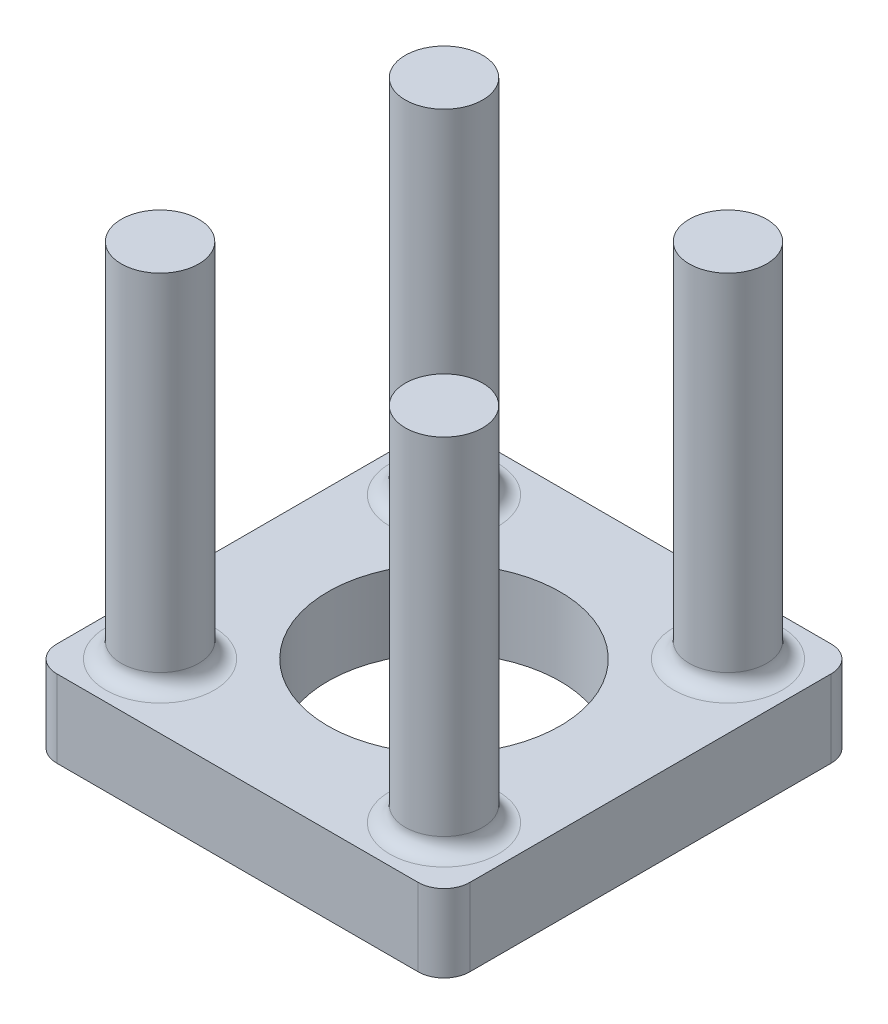
from build123d import *

# Parameters (mm, degrees)
SKETCH_1_W      = 80
SKETCH_1_H      = 80
SKETCH_1_R      = 22.5
EXTRUDE_1_DEPTH = 15
FILLET_1_R      = 5
SKETCH_2_R      = 7.5
EXTRUDE_2_DEPTH = 70
FILLET_2_R      = 3


with BuildPart() as part:
    # 草圖1 → 填料-伸長1 (new body)
    with BuildSketch(Plane(origin=(0, 0, 0), x_dir=(1, 0, 0), z_dir=(0, 1, 0))):
        with Locations((11.024390244, -21.451219512)):
            Rectangle(SKETCH_1_W, SKETCH_1_H)
        with Locations(Location((11.024390244, -21.451219512, 0), (0, 0, 270))):
            Circle(SKETCH_1_R, mode=Mode.SUBTRACT)
    extrude(amount=EXTRUDE_1_DEPTH)

    # 圓角1
    fillet_1_edges = [part.edges().sort_by_distance(p)[0] for p in [
        (-28.975609756, 7.5, -18.548780488),
        (51.024390244, 7.5, -18.548780488),
        (51.024390244, 7.5, 61.451219512),
        (-28.975609756, 7.5, 61.451219512),
    ]]
    fillet(fillet_1_edges, radius=FILLET_1_R)

    # 草圖2 → 填料-伸長2 (add)
    with BuildSketch(Plane(origin=(0, 15, 0), x_dir=(1, 0, 0), z_dir=(0, 1, 0))):
        with Locations(Location((-16.475609756, 6.048780488, 0), (0, 0, 270))):
            Circle(SKETCH_2_R)
        with Locations(Location((38.524390244, 6.048780488, 0), (0, 0, 270))):
            Circle(SKETCH_2_R)
        with Locations(Location((38.524390244, -48.951219512, 0), (0, 0, 270))):
            Circle(SKETCH_2_R)
        with Locations(Location((-16.475609756, -48.951219512, 0), (0, 0, 270))):
            Circle(SKETCH_2_R)
    extrude(amount=EXTRUDE_2_DEPTH)

    # 圓角2
    fillet_2_edges = [part.edges().sort_by_distance(p)[0] for p in [
        (-16.475609756, 15, -13.548780488),
        (38.524390244, 15, -13.548780488),
        (38.524390244, 15, 41.451219512),
        (-16.475609756, 15, 41.451219512),
    ]]
    fillet(fillet_2_edges, radius=FILLET_2_R)


solid = part.part
